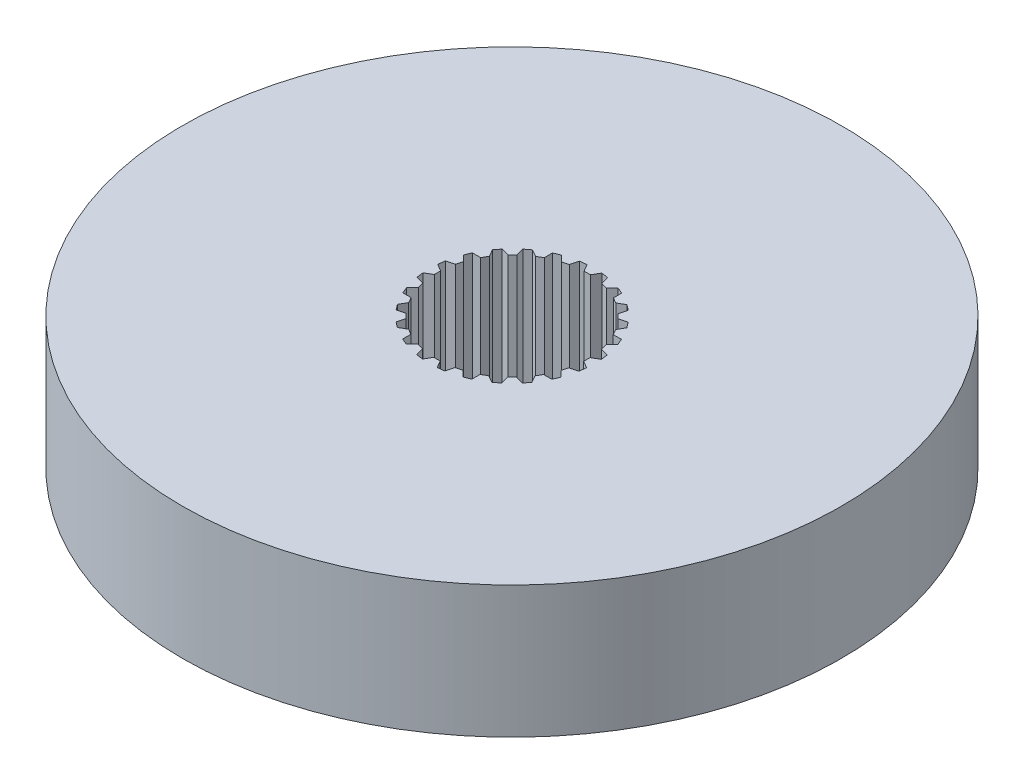
from build123d import *

# Parameters (mm, degrees)
SKETCH8_R           = 100
BOSS_EXTRUDE4_DEPTH = 40
CUT_EXTRUDE1_DEPTH  = 147.969384567


with BuildPart() as part:
    # Sketch8 → Boss-Extrude4 (new body)
    with BuildSketch(Plane(origin=(0, 0, 0), x_dir=(1, 0, 0), z_dir=(0, 1, 0))):
        with Locations(Location((0, 0, 0), (0, 0, 270))):
            Circle(SKETCH8_R)
    extrude(amount=BOSS_EXTRUDE4_DEPTH)

    # Sketch6 → Cut-Extrude1 (cut, through all)
    with BuildSketch(Plane(origin=(0, 0, 0), x_dir=(1, 0, 0), z_dir=(0, 1, 0))):
        Polygon((-0.9689411, -22.736267788), (0.9689411, -22.736267788), (2.2189411, -24.901331298), (4.303288018, -24.645405677), (4.950335631, -22.230591111), (6.822186096, -21.72903029), (8.589953049, -23.496797243), (10.537039143, -22.710123397), (10.537039143, -20.210123397), (12.215294358, -19.241182297), (14.380357867, -20.491182297), (16.057492438, -19.227370749), (15.410444825, -16.812556183), (16.78073447, -15.442266539), (19.195549035, -16.089314151), (20.488438134, -14.434491569), (19.238438134, -12.269428059), (20.207379233, -10.591172845), (22.707379233, -10.591172845), (23.527914603, -8.658112653), (21.76014765, -6.8903457), (22.261708471, -5.018495235), (24.676523036, -4.371447622), (24.968786548, -2.291884678), (22.803723039, -1.041884678), (22.803723039, 0.895997521), (24.968786548, 2.145997521), (24.712860927, 4.23034444), (22.298046362, 4.877392053), (21.796485541, 6.749242517), (23.564252494, 8.51700947), (22.777578648, 10.464095565), (20.277578648, 10.464095565), (19.308637548, 12.142350779), (20.558637548, 14.307414289), (19.294826, 15.98454886), (16.880011434, 15.337501247), (15.509721789, 16.707790891), (16.156769402, 19.122605457), (14.50194682, 20.415494555), (12.33688331, 19.165494555), (10.658628096, 20.134435655), (10.658628096, 22.634435655), (8.725567904, 23.454971025), (6.957800951, 21.687204072), (5.085950486, 22.188764892), (4.438902873, 24.603579458), (2.359339929, 24.89584297), (1.109339929, 22.730779461), (-0.828542271, 22.730779461), (-2.078542271, 24.89584297), (-4.162889189, 24.639917349), (-4.809936802, 22.225102783), (-6.681787267, 21.723541963), (-8.44955422, 23.491308916), (-10.396640314, 22.70463507), (-10.396640314, 20.20463507), (-12.074895529, 19.23569397), (-14.239959038, 20.48569397), (-15.917093609, 19.221882421), (-15.270045996, 16.807067856), (-16.640335641, 15.436778211), (-19.055150206, 16.083825824), (-20.348039305, 14.429003241), (-19.098039305, 12.263939732), (-20.066980404, 10.585684518), (-22.566980404, 10.585684518), (-23.387515774, 8.652624325), (-21.619748821, 6.884857372), (-22.121309642, 5.013006908), (-24.536124207, 4.365959295), (-24.828387719, 2.28639635), (-22.66332421, 1.03639635), (-22.66332421, -0.901485849), (-24.828387719, -2.151485849), (-24.572462098, -4.235832767), (-22.157647532, -4.88288038), (-21.656086712, -6.754730845), (-23.423853665, -8.522497798), (-22.637179819, -10.469583893), (-20.137179819, -10.469583893), (-19.168238719, -12.147839107), (-20.418238719, -14.312902616), (-19.154427171, -15.990037187), (-16.739612605, -15.342989575), (-15.36932296, -16.713279219), (-16.016370573, -19.128093785), (-14.361547991, -20.420982883), (-12.196484481, -19.170982883), (-10.518229267, -20.139923983), (-10.518229267, -22.639923983), (-8.585169075, -23.460459352), (-6.817402122, -21.6926924), (-4.945551657, -22.19425322), (-4.298504044, -24.609067786), (-2.2189411, -24.901331298), align=None)
    extrude(amount=CUT_EXTRUDE1_DEPTH, mode=Mode.SUBTRACT)


solid = part.part
